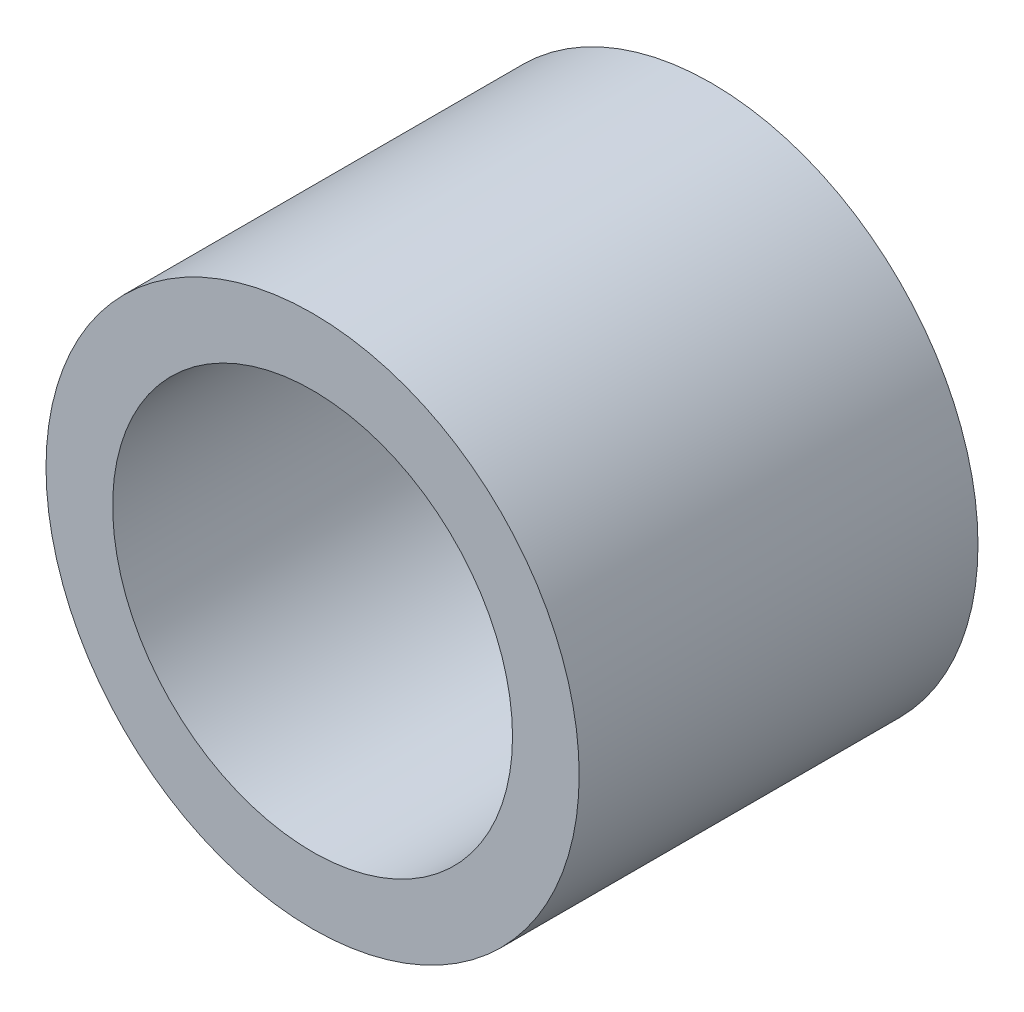
from build123d import *

# Parameters (mm, degrees)
SKETCH1_R           = 12.7
SKETCH1_R_2         = 9.525
BOSS_EXTRUDE1_DEPTH = 9.5


with BuildPart() as part:
    # Sketch1 → Boss-Extrude1 (new, symmetric)
    with BuildSketch(Plane.XY):
        Circle(SKETCH1_R)
        Circle(SKETCH1_R_2, mode=Mode.SUBTRACT)
    extrude(amount=BOSS_EXTRUDE1_DEPTH, both=True)


solid = part.part
